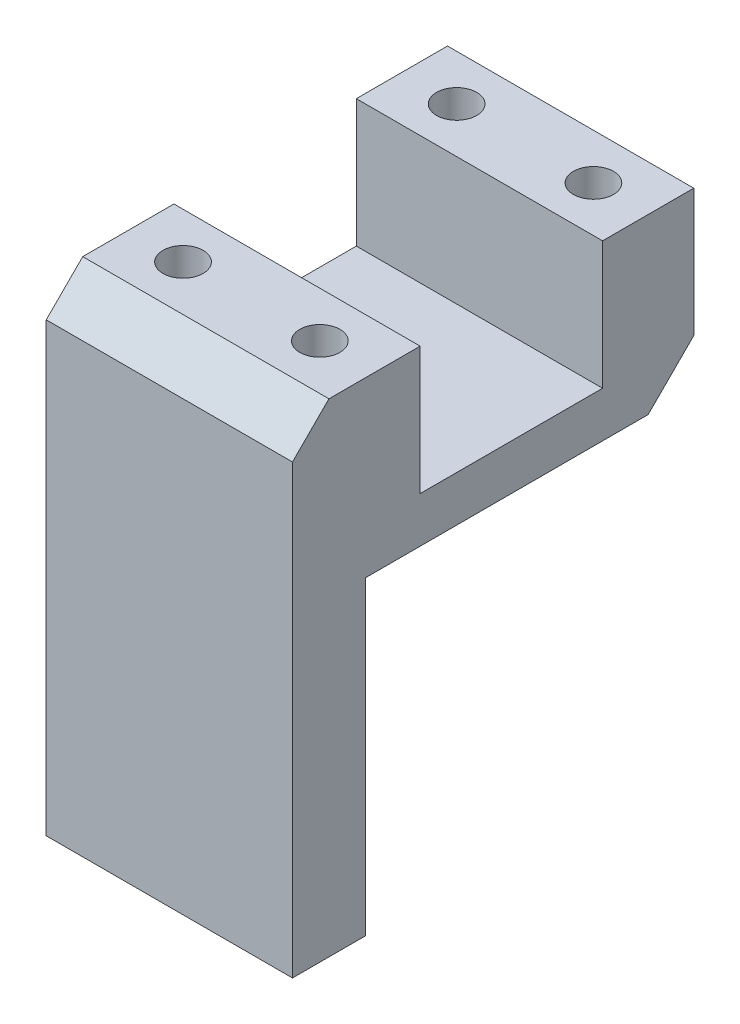
from build123d import *

# Parameters (mm, degrees)
EXTRUDE1_DEPTH     = 8.5725
SKETCH2_R          = 1.397
CUT_EXTRUDE1_DEPTH = 6.35


with BuildPart() as part:
    # Sketch1 → Extrude1 (new, symmetric)
    with BuildSketch(Plane(origin=(0, 0, 0), x_dir=(0, 0, -1), z_dir=(1, 0, 0))):
        Polygon((-2.54, 28.575), (-2.54, -2.54), (2.54, -2.54), (2.54, 19.05), (22.225, 19.05), (25.4, 22.225), (25.4, 31.115), (19.05, 31.115), (19.05, 22.225), (6.35, 22.225), (6.35, 31.115), (0, 31.115), align=None)
    extrude(amount=EXTRUDE1_DEPTH, both=True)

    # Sketch2 → Cut-Extrude1 (cut)
    with BuildSketch(Plane(origin=(0, 31.115, 0), x_dir=(-1, 0, 0), z_dir=(0, 1, 0))):
        with Locations((-4.7625, -22.225)):
            Circle(SKETCH2_R)
        with Locations((4.7625, -22.225)):
            Circle(SKETCH2_R)
        with Locations((-4.7625, -3.175)):
            Circle(SKETCH2_R)
        with Locations((4.7625, -3.175)):
            Circle(SKETCH2_R)
    extrude(amount=-CUT_EXTRUDE1_DEPTH, mode=Mode.SUBTRACT)


solid = part.part
